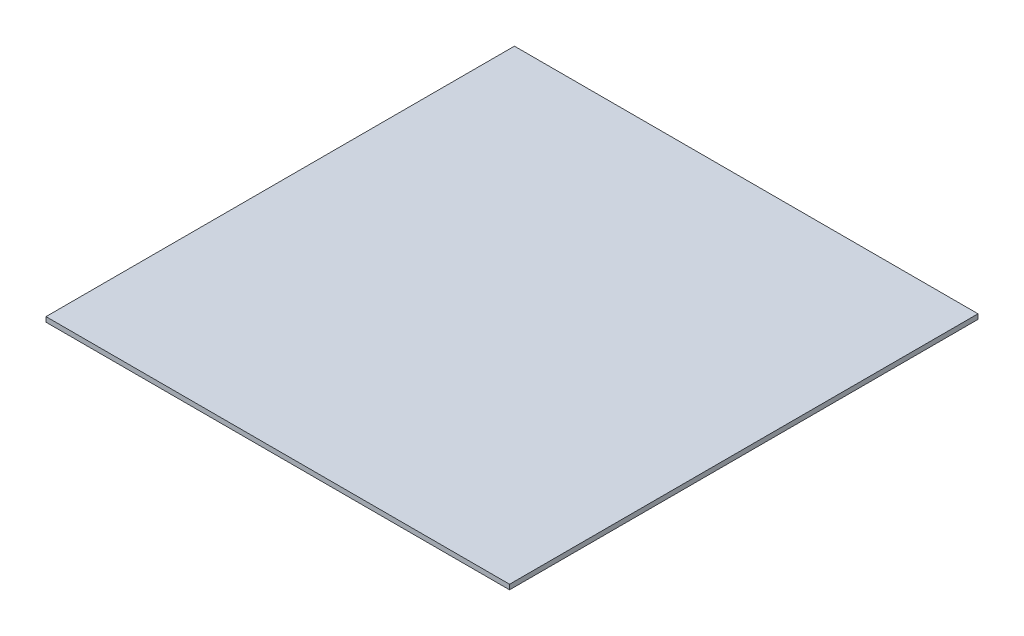
from build123d import *

# Parameters (mm, degrees)
SKETCH1_W           = 301.625
SKETCH1_H           = 304.8
BOSS_EXTRUDE1_DEPTH = 3.175


with BuildPart() as part:
    # Sketch1 → Boss-Extrude1 (new body)
    with BuildSketch(Plane(origin=(0, 0, 0), x_dir=(1, 0, 0), z_dir=(0, 1, 0))):
        with Locations((128.659243377, 123.212458101)):
            Rectangle(SKETCH1_W, SKETCH1_H)
    extrude(amount=BOSS_EXTRUDE1_DEPTH)


solid = part.part
